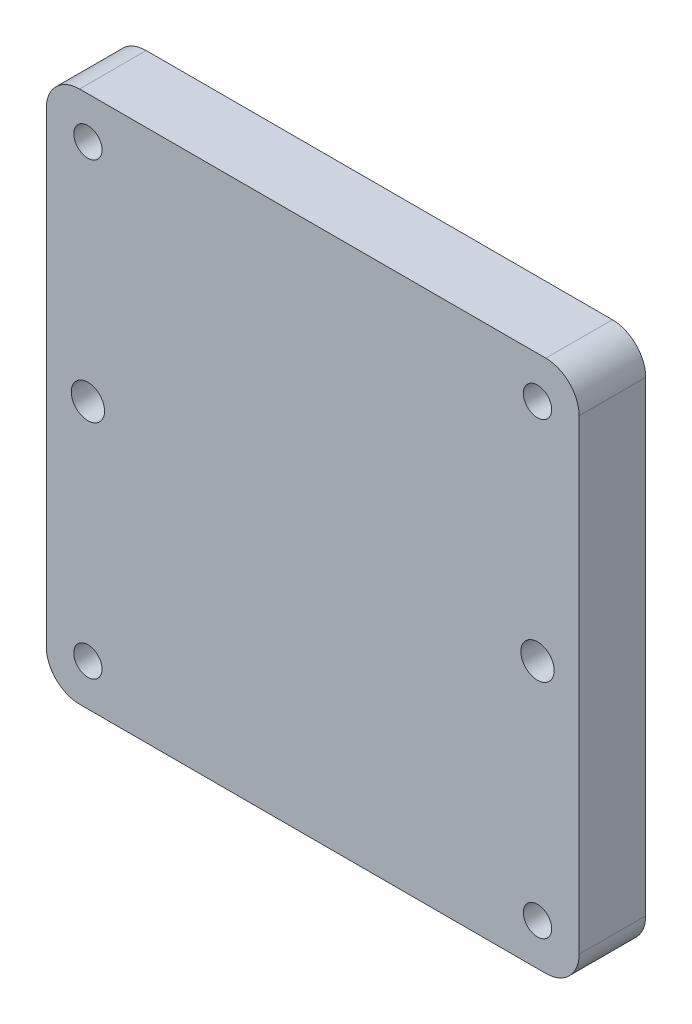
from build123d import *

# Parameters (mm, degrees)
TOP_PLATE_SKETCH_PROFILE_R   = 3.175
TOP_PLATE_SKETCH_PROFILE_R_2 = 2.69875
TOP_PLATE_EXTRUDE_DEPTH      = 12.7


with BuildPart() as part:
    # Top Plate Sketch Profile → Top Plate Extrude (new body)
    with BuildSketch(Plane.XY.offset(114.3)):
        with BuildLine():
            Line((50.8, 44.45), (50.8, -44.45))
            ThreePointArc((50.8, -44.45), (48.940128061, -48.940128061), (44.45, -50.8))
            Line((44.45, -50.8), (-44.45, -50.8))
            ThreePointArc((-44.45, -50.8), (-48.940128061, -48.940128061), (-50.8, -44.45))
            Line((-50.8, -44.45), (-50.8, 44.45))
            ThreePointArc((-50.8, 44.45), (-48.940128061, 48.940128061), (-44.45, 50.8))
            Line((-44.45, 50.8), (44.45, 50.8))
            ThreePointArc((44.45, 50.8), (48.940128061, 48.940128061), (50.8, 44.45))
        make_face()
        with Locations((42.8625, 0)):
            Circle(TOP_PLATE_SKETCH_PROFILE_R, mode=Mode.SUBTRACT)
        with Locations((-42.8625, 0)):
            Circle(TOP_PLATE_SKETCH_PROFILE_R, mode=Mode.SUBTRACT)
        with Locations((-42.8625, 42.8625)):
            Circle(TOP_PLATE_SKETCH_PROFILE_R_2, mode=Mode.SUBTRACT)
        with Locations((42.8625, 42.8625)):
            Circle(TOP_PLATE_SKETCH_PROFILE_R_2, mode=Mode.SUBTRACT)
        with Locations((42.8625, -42.8625)):
            Circle(TOP_PLATE_SKETCH_PROFILE_R_2, mode=Mode.SUBTRACT)
        with Locations((-42.8625, -42.8625)):
            Circle(TOP_PLATE_SKETCH_PROFILE_R_2, mode=Mode.SUBTRACT)
    extrude(amount=-TOP_PLATE_EXTRUDE_DEPTH)


solid = part.part
